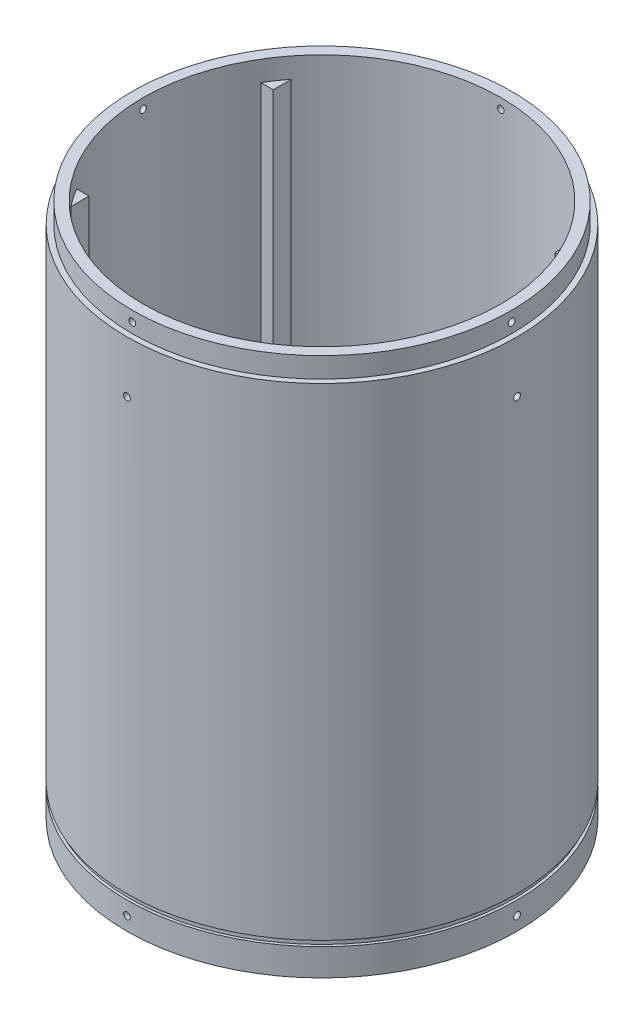
from build123d import *

# Parameters (mm, degrees)
SKETCH_6_R               = 72
SKETCH_6_R_2             = 70
EXTRUDE_1_DEPTH          = 190
SKETCH_6_15_R            = 70
SKETCH_6_15_R_2          = 66
EXTRUDE_2_DEPTH          = 197.5
SKETCH_6_16_R            = 66
EXTRUDE_3_DEPTH          = 3
EXTRUDE_6_DEPTH          = 190
F_2_5MM_3_D              = 2.5
F_2_5MM_3_DEPTH          = 70
PATTERN_CIRCULAR_1_COUNT = 4
SKETCH_33_W              = 1
SKETCH_33_H              = 2
PATTERN_CIRCULAR_2_COUNT = 4
PATTERN_CIRCULAR_3_COUNT = 4
SKETCH_40_W              = 72
SKETCH_40_H              = 21.317266744
EXTRUDE_8_DEPTH          = 70


with BuildPart() as part:
    # 草圖6 → 填料-伸長1 (new body)
    with BuildSketch(Plane(origin=(0, 0, 0), x_dir=(1, 0, 0), z_dir=(0, 1, 0))):
        with Locations(Location((0, 0, 0), (0, 0, 270))):
            Circle(SKETCH_6_R)
        with Locations(Location((0, 0, 0), (0, 0, 270))):
            Circle(SKETCH_6_R_2, mode=Mode.SUBTRACT)
    extrude(amount=EXTRUDE_1_DEPTH)

    # 草圖6<15> → 填料-伸長2 (add)
    with BuildSketch(Plane(origin=(0, 0, 0), x_dir=(1, 0, 0), z_dir=(0, 1, 0))):
        with Locations(Location((0, 0, 0), (0, 0, 90))):
            Circle(SKETCH_6_15_R)
        with Locations(Location((0, 0, 0), (0, 0, 90))):
            Circle(SKETCH_6_15_R_2, mode=Mode.SUBTRACT)
    extrude(amount=EXTRUDE_2_DEPTH)

    # 草圖6<16> → 填料-伸長3 (add)
    with BuildSketch(Plane(origin=(0, 0, 0), x_dir=(1, 0, 0), z_dir=(0, 1, 0))):
        with Locations(Location((0, 0, 0), (0, 0, 90))):
            Circle(SKETCH_6_16_R)
    extrude(amount=EXTRUDE_3_DEPTH)

    # 草圖9 → 填料-伸長6 (add)
    with BuildSketch(Plane(origin=(0, 0, 0), x_dir=(1, 0, 0), z_dir=(0, 1, 0))):
        with BuildLine():
            Line((-52, 34), (-52, 40.644802866))
            ThreePointArc((-52, 40.644802866), (-54.38584794, 37.392239086), (-56.568542495, 34))
            Line((-56.568542495, 34), (-52, 34))
        make_face()
        with BuildLine():
            Line((-52, -34), (-56.568542495, -34))
            ThreePointArc((-56.568542495, -34), (-54.38584794, -37.392239086), (-52, -40.644802866))
            Line((-52, -40.644802866), (-52, -34))
        make_face()
        with BuildLine():
            Line((56.568542495, -34), (52, -34))
            Line((52, -34), (52, -40.644802866))
            ThreePointArc((52, -40.644802866), (54.38584794, -37.392239086), (56.568542495, -34))
        make_face()
        with BuildLine():
            ThreePointArc((56.568542495, 34), (54.38584794, 37.392239086), (52, 40.644802866))
            Line((52, 40.644802866), (52, 34))
            Line((52, 34), (56.568542495, 34))
        make_face()
    extrude(amount=EXTRUDE_6_DEPTH)

    # Ø2.5mm 定位孔3
    with Locations(Plane(origin=(70, 193.75, 0), x_dir=(0, 0, 1), z_dir=(1, 0, 0))):
        with Locations((0, 0)):
            f_2_5mm_3 = Hole(F_2_5MM_3_D / 2, depth=F_2_5MM_3_DEPTH)

    # 環狀複製排列1: Ø2.5mm 定位孔3 ×4 about axis
    pattern_circular_1_axis = Axis((0, 197.5, 0), (0, 1, 0))
    for i in range(1, PATTERN_CIRCULAR_1_COUNT):
        add(f_2_5mm_3.rotate(pattern_circular_1_axis, i * 360 / PATTERN_CIRCULAR_1_COUNT), mode=Mode.SUBTRACT)

    # 草圖33 → 除料-旋轉1 (revolve, cut)
    with BuildSketch(Plane.XY, mode=Mode.PRIVATE) as cut_revolve_1_sk:
        with Locations((-71.5, 11)):
            Rectangle(SKETCH_33_W, SKETCH_33_H)
    revolve(cut_revolve_1_sk.sketch.rotate(Axis((0, 197.5, 0), (0, -1, 0)), 270), axis=Axis((0, 197.5, 0), (0, -1, 0)), mode=Mode.SUBTRACT)

    # 草圖37 → Ø2.5mm 定位孔4 (revolve, cut)
    with BuildSketch(Plane(origin=(-72, 5, 0), x_dir=(0, 0, 1), z_dir=(0, 1, 0))):
        Polygon((0, 0), (0, 4.751075774), (1.25, 4), (1.25, 0), align=None)
    f_2_5mm_4 = revolve(axis=Axis((-78.35, 5, 0), (1, 0, 0)), mode=Mode.SUBTRACT)

    # 環狀複製排列2: Ø2.5mm 定位孔4 ×4 about axis
    pattern_circular_2_axis = Axis((0, 197.5, 0), (0, -1, 0))
    for i in range(1, PATTERN_CIRCULAR_2_COUNT):
        add(f_2_5mm_4.rotate(pattern_circular_2_axis, i * 360 / PATTERN_CIRCULAR_2_COUNT), mode=Mode.SUBTRACT)

    # 草圖38 → Ø2.5mm 定位孔5 (revolve, cut)
    with BuildSketch(Plane(origin=(-72, 170.901826282, 0), x_dir=(0, 0, 1), z_dir=(0, 1, 0))):
        Polygon((0, 0), (0, 4.751075774), (1.25, 4), (1.25, 0), align=None)
    f_2_5mm_5 = revolve(axis=Axis((-78.35, 170.901826282, 0), (1, 0, 0)), mode=Mode.SUBTRACT)

    # 環狀複製排列3: Ø2.5mm 定位孔5 ×4 about axis
    pattern_circular_3_axis = Axis((0, 197.5, 0), (0, -1, 0))
    for i in range(1, PATTERN_CIRCULAR_3_COUNT):
        add(f_2_5mm_5.rotate(pattern_circular_3_axis, i * 360 / PATTERN_CIRCULAR_3_COUNT), mode=Mode.SUBTRACT)


with BuildPart() as body_2:
    # 草圖40 → 填料-伸長8 (new body)
    with BuildSketch(Plane(origin=(0, 3, 0), x_dir=(1, 0, 0), z_dir=(0, 1, 0))):
        with Locations((0, 44.658633372)):
            Rectangle(SKETCH_40_W, SKETCH_40_H)
    extrude(amount=EXTRUDE_8_DEPTH)


solid = Compound([part.part, body_2.part])
